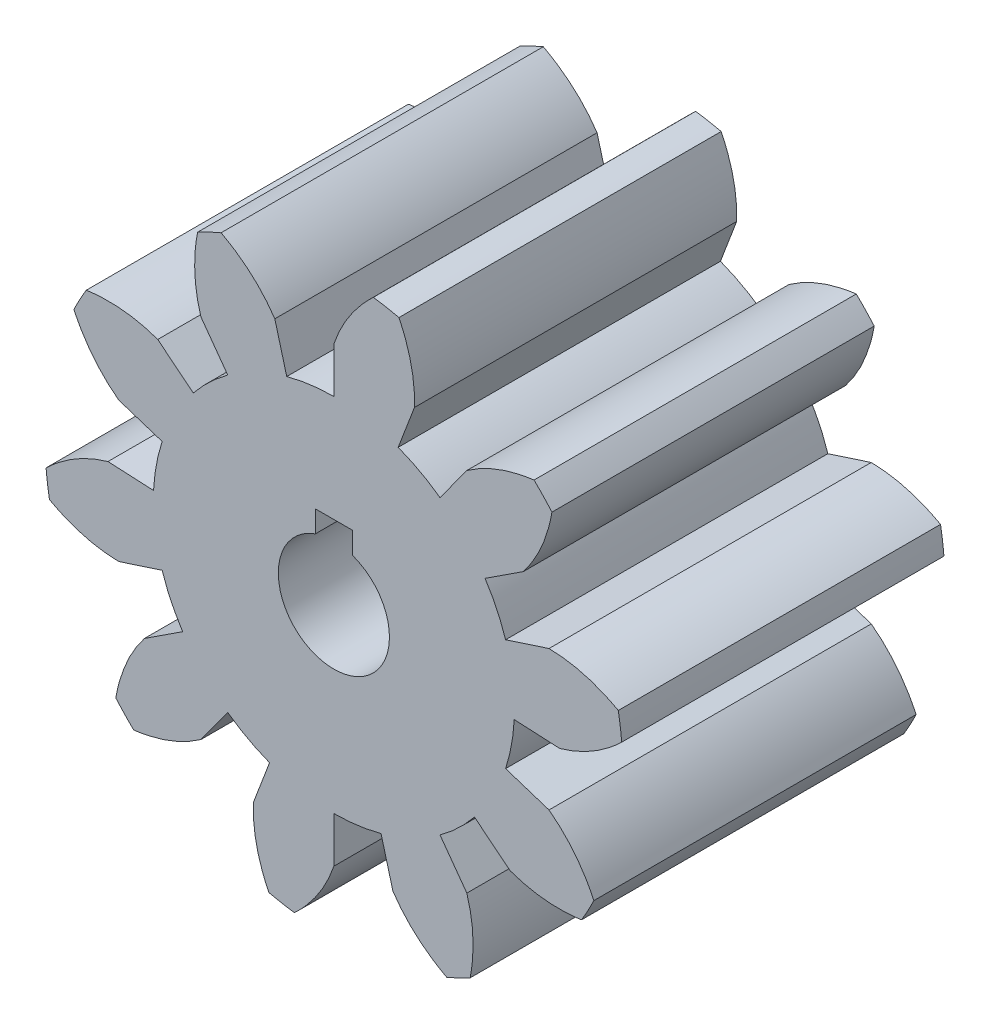
from build123d import *

# Parameters (mm, degrees)
BOSS_EXTRUDE1_DEPTH = 43.5
CIRPATTERN1_COUNT   = 10
SKETCH2_R           = 7.5
CUT_EXTRUDE1_DEPTH  = 70.959609915
SKETCH3_W           = 5
SKETCH3_H           = 5
CUT_EXTRUDE2_DEPTH  = 70.959609915


with BuildPart() as part:
    # Sketch1 → Boss-Extrude1 (new body)
    with BuildSketch(Plane.XY):
        with BuildLine():
            add(Edge.make_bspline(
                [(0, 30.535), (1.094025697, 33.738879921), (2.960368297, 36.423385517), (5.329249796, 38.634170065)],
                knots=[0, 0, 0, 0, 0.089409401, 0.089409401, 0.089409401, 0.089409401], degree=3))
            Line((0, 30.535), (0, 24.375))
            ThreePointArc((0, 24.375), (-4.413773565, -23.972050974), (8.681616812, 22.776526393))
            Line((8.681616812, 22.776526393), (10.875617204, 28.532563422))
            add(Edge.make_bspline(
                [(10.875617204, 28.532563422), (10.994458338, 31.915995933), (10.206644899, 35.089189117), (8.780523558, 37.998715847)],
                knots=[0, 0, 0, 0, 0.089409401, 0.089409401, 0.089409401, 0.089409401], degree=3))
            ThreePointArc((8.780523558, 37.998715847), (7.062037704, 38.355281559), (5.329249796, 38.634170065))
        make_face()
    boss_extrude1 = extrude(amount=BOSS_EXTRUDE1_DEPTH)

    # CirPattern1: Boss-Extrude1 ×10 about axis
    cirpattern1_axis = Axis((0, 0, 0), (0, 0, -1))
    for i in range(1, CIRPATTERN1_COUNT):
        add(boss_extrude1.rotate(cirpattern1_axis, i * 360 / CIRPATTERN1_COUNT))

    # Sketch2 → Cut-Extrude1 (cut, through all)
    with BuildSketch(Plane.XY.offset(43.5)):
        Circle(SKETCH2_R)
    extrude(amount=-CUT_EXTRUDE1_DEPTH, mode=Mode.SUBTRACT)

    # Sketch3 → Cut-Extrude2 (cut, through all)
    with BuildSketch(Plane.XY.offset(43.5)):
        with Locations((0, 7.5)):
            Rectangle(SKETCH3_W, SKETCH3_H)
    extrude(amount=-CUT_EXTRUDE2_DEPTH, mode=Mode.SUBTRACT)


solid = part.part
